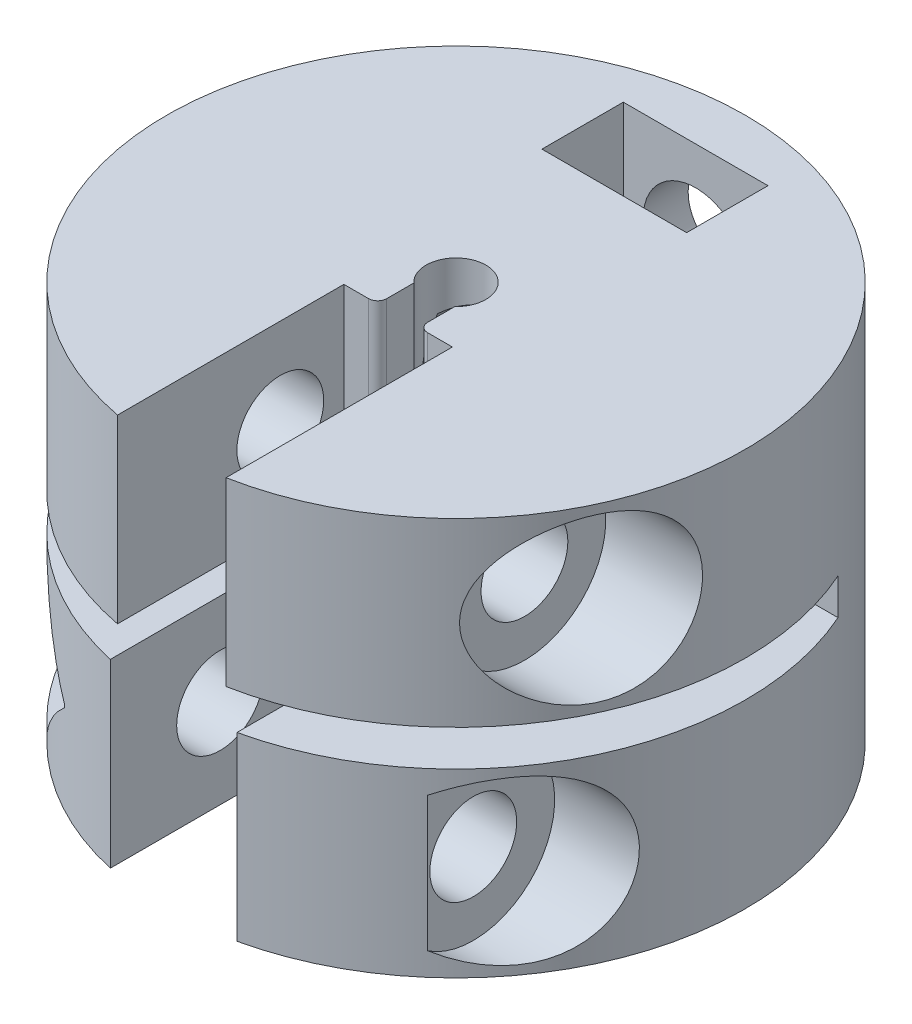
from build123d import *

# Parameters (mm, degrees)
SKETCH1_W                            = 4.75
SKETCH1_H                            = 7
FILLET1_R                            = 1
SKETCH16_W                           = 16
SKETCH16_H                           = 1
CUT_EXTRUDE5_DEPTH                   = 1
CUT_EXTRUDE5_DIRECTION_2_REACH       = 18.492
CUT_EXTRUDE6_REACH                   = 15.304
SKETCH17_W                           = 3.5
SKETCH17_H                           = 5.261387212
CUT_EXTRUDE7_DEPTH                   = 18.408690359
CUT_EXTRUDE7_DEPTH_BACK              = 18.408690359
SKETCH18_R                           = 1.2
CUT_EXTRUDE10_START                  = -6
SKETCH21_R                           = 0.825
CUT_EXTRUDE10_DEPTH                  = 6
CUT_EXTRUDE11_DEPTH                  = 18.26991621
CUT_EXTRUDE11_DEPTH_BACK             = 18.26991621
SKETCH22_R                           = 1.2
CUT_EXTRUDE9_REACH                   = 20.603
CUT_EXTRUDE9_END_RADIUS              = 8
SKETCH20_R                           = 1.2
CUT_EXTRUDE12_REACH                  = 21.585
SKETCH19_R                           = 2.25
CUT_EXTRUDE13_REACH                  = 21.585
CUT_EXTRUDE13_END_RADIUS             = 8
SKETCH24_R                           = 2.25
CUT_EXTRUDE14_REACH                  = 18.492
CUT_EXTRUDE14_END_RADIUS             = 8
SKETCH25_W                           = 2.25
SKETCH25_H                           = 1
CUT_EXTRUDE14_DIRECTION_2_REACH      = 18.492
CUT_EXTRUDE14_DIRECTION_2_END_RADIUS = 8
M2_5_CLEARANCE_HOLE1_D               = 2.9
M2_5_CLEARANCE_HOLE1_DEPTH           = 7.729752102
M2_5_CLEARANCE_HOLE1_TIP             = 0.871247898
CUT_EXTRUDE15_START                  = -12
SKETCH29_W                           = 4
SKETCH29_H                           = 2.25
CUT_EXTRUDE15_DEPTH                  = 12
FILLET3_R                            = 0.25
SKETCH30_R                           = 8
CUT_EXTRUDE19_DEPTH                  = 1


with BuildPart() as part:
    # Sketch1 → Revolve1 (revolve)
    with BuildSketch(Plane.XY, mode=Mode.PRIVATE) as revolve1_sk:
        with Locations((5.625, 3.5)):
            Rectangle(SKETCH1_W, SKETCH1_H)
    revolve(revolve1_sk.sketch.rotate(Axis((0, 0, 0), (0, 1, 0)), 90), axis=Axis((0, 0, 0), (0, 1, 0)))

    # Sketch1<3> → Revolve2 (revolve)
    with BuildSketch(Plane.XY, mode=Mode.PRIVATE) as revolve2_sk:
        Polygon((0.825, 7), (3.25, 7), (8, 7), (8, 12), (0.825, 12), align=None)
    revolve(revolve2_sk.sketch.rotate(Axis((0, 0, 0), (0, 1, 0)), 90), axis=Axis((0, 0, 0), (0, 1, 0)))

    # Fillet1
    fillet1_edges = [part.edges().sort_by_distance(p)[0] for p in [
        (0, 12, 8),
    ]]
    fillet(fillet1_edges, radius=FILLET1_R)

    # Sketch16 → Cut-Extrude5 (cut)
    with BuildSketch(Plane.XY):
        with Locations((0, 5.5)):
            Rectangle(SKETCH16_W, SKETCH16_H)
    extrude(amount=-CUT_EXTRUDE5_DEPTH, mode=Mode.SUBTRACT)

    # Sketch16 → Cut-Extrude5 direction 2 (cut, up to next)
    with BuildSketch(Plane.XY, mode=Mode.PRIVATE) as cut_extrude5_direction_2_sk1:
        with Locations((0, 5.5)):
            Rectangle(SKETCH16_W, SKETCH16_H)
    cut_extrude5_direction_2_tool1 = extrude(cut_extrude5_direction_2_sk1.sketch, amount=CUT_EXTRUDE5_DIRECTION_2_REACH, mode=Mode.PRIVATE) & part.part
    add(cut_extrude5_direction_2_tool1.solids().sort_by_distance((0, 5.5, 0))[0], mode=Mode.SUBTRACT)

    # Sketch17 → Cut-Extrude6 (cut, up to next)
    with BuildSketch(Plane(origin=(0, 5, 0), x_dir=(1, 0, 0), z_dir=(0, 1, 0)), mode=Mode.PRIVATE) as cut_extrude6_sk1:
        with Locations((0, -5.369306394)):
            Rectangle(SKETCH17_W, SKETCH17_H)
    cut_extrude6_tool1 = extrude(cut_extrude6_sk1.sketch, amount=-CUT_EXTRUDE6_REACH, mode=Mode.PRIVATE) & part.part
    add(cut_extrude6_tool1.solids().sort_by_distance((0, 5, 5.369306))[0], mode=Mode.SUBTRACT)

    # Sketch18 → Cut-Extrude7 (cut, two sides: drawn at the far end of the back side and taken through both)
    with BuildSketch(Plane.ZY.offset(-1.75).offset(-CUT_EXTRUDE7_DEPTH_BACK)):
        with Locations((4.772430143, 2.5)):
            Circle(SKETCH18_R)
    extrude(amount=CUT_EXTRUDE7_DEPTH + CUT_EXTRUDE7_DEPTH_BACK, mode=Mode.SUBTRACT)

    # Sketch21 → Cut-Extrude10 (cut)
    with BuildSketch(Plane(origin=(0, 12, 0), x_dir=(1, 0, 0), z_dir=(0, 1, 0)).offset(CUT_EXTRUDE10_START)):
        Circle(SKETCH21_R)
        Polygon((-1.5, -1.6), (-1.5, -11.891029443), (1.5, -11.891029443), (1.5, -1.6), (0.566237583, -1.6), (0.566237583, -0.6), (-0.566237583, -0.6), (-0.566237583, -1.6), align=None)
    extrude(amount=CUT_EXTRUDE10_DEPTH, mode=Mode.SUBTRACT)

    # Sketch22 → Cut-Extrude11 (cut, two sides: drawn at the far end of the back side and taken through both)
    with BuildSketch(Plane(origin=(-1.5, 0, 0), x_dir=(0, 0, -1), z_dir=(1, 0, 0)).offset(-CUT_EXTRUDE11_DEPTH_BACK)):
        with Locations((-3.358116823, 8.5)):
            Circle(SKETCH22_R)
    extrude(amount=CUT_EXTRUDE11_DEPTH + CUT_EXTRUDE11_DEPTH_BACK, mode=Mode.SUBTRACT)

    # Cut-Extrude9: up to this cylinder (the profile starts inside it)
    cut_extrude9_end = Plane(origin=(0, 5.9847245, 0), z_dir=(0, -1, 0)) * Cylinder(CUT_EXTRUDE9_END_RADIUS, 65.175449, mode=Mode.PRIVATE)
    # Sketch20 → Cut-Extrude9 (cut, up to the surface)
    with BuildSketch(Plane(origin=(-3.75, 0, 0), x_dir=(0, 0, -1), z_dir=(1, 0, 0)), mode=Mode.PRIVATE) as cut_extrude9_sk1:
        Polygon((-2.463029066, 2.5), (-3.617729604, 4.5), (-5.927130681, 4.5), (-7.08183122, 2.5), (-5.927130681, 0.5), (-3.617729604, 0.5), align=None)
    cut_extrude9_tool1 = extrude(cut_extrude9_sk1.sketch, amount=-CUT_EXTRUDE9_REACH, mode=Mode.PRIVATE) & cut_extrude9_end
    add(cut_extrude9_tool1.solids().sort_by_distance((-3.75, 2.5, 4.77243))[0], mode=Mode.SUBTRACT)
    # Sketch20 → Cut-Extrude9 (cut, up to the surface)
    with BuildSketch(Plane(origin=(-3.75, 0, 0), x_dir=(0, 0, -1), z_dir=(1, 0, 0)), mode=Mode.PRIVATE) as cut_extrude9_sk2:
        Polygon((-1.048715746, 8.5), (-2.203416284, 10.5), (-4.512817361, 10.5), (-5.6675179, 8.5), (-4.512817361, 6.5), (-2.203416284, 6.5), align=None)
        with Locations((-3.358116823, 8.5)):
            Circle(SKETCH20_R, mode=Mode.SUBTRACT)
    cut_extrude9_tool2 = extrude(cut_extrude9_sk2.sketch, amount=-CUT_EXTRUDE9_REACH, mode=Mode.PRIVATE) & cut_extrude9_end
    add(cut_extrude9_tool2.solids().sort_by_distance((-3.75, 9.469449, 1.678981))[0], mode=Mode.SUBTRACT)

    # Sketch19 → Cut-Extrude12 (cut, up to next)
    with BuildSketch(Plane.ZY.offset(-5.25), mode=Mode.PRIVATE) as cut_extrude12_sk1:
        with Locations((4.772430143, 2.5)):
            Circle(SKETCH19_R)
    cut_extrude12_tool1 = extrude(cut_extrude12_sk1.sketch, amount=-CUT_EXTRUDE12_REACH, mode=Mode.PRIVATE) & part.part
    add(cut_extrude12_tool1.solids().sort_by_distance((5.25, 2.5, 4.77243))[0], mode=Mode.SUBTRACT)

    # Cut-Extrude13: up to this cylinder (the profile starts inside it)
    cut_extrude13_end = Plane(origin=(0, 8.5, 0), z_dir=(0, -1, 0)) * Cylinder(CUT_EXTRUDE13_END_RADIUS, 60.17, mode=Mode.PRIVATE)
    # Sketch24 → Cut-Extrude13 (cut, up to the surface)
    with BuildSketch(Plane.ZY.offset(-5.25), mode=Mode.PRIVATE) as cut_extrude13_sk1:
        with Locations((3.358116823, 8.5)):
            Circle(SKETCH24_R)
    cut_extrude13_tool1 = extrude(cut_extrude13_sk1.sketch, amount=-CUT_EXTRUDE13_REACH, mode=Mode.PRIVATE) & cut_extrude13_end
    add(cut_extrude13_tool1.solids().sort_by_distance((5.25, 8.5, 3.358117))[0], mode=Mode.SUBTRACT)

    # Cut-Extrude14: up to this cylinder (the profile starts inside it)
    cut_extrude14_end = Plane(origin=(0, 5.5, 0), z_dir=(0, -1, 0)) * Cylinder(CUT_EXTRUDE14_END_RADIUS, 53.984, mode=Mode.PRIVATE)
    # Sketch25 → Cut-Extrude14 (cut, up to the surface)
    with BuildSketch(Plane.ZY, mode=Mode.PRIVATE) as cut_extrude14_sk1:
        with Locations((-2.125, 5.5)):
            Rectangle(SKETCH25_W, SKETCH25_H)
    cut_extrude14_tool1 = extrude(cut_extrude14_sk1.sketch, amount=-CUT_EXTRUDE14_REACH, mode=Mode.PRIVATE) & cut_extrude14_end
    add(cut_extrude14_tool1.solids().sort_by_distance((0, 5.5, -2.125))[0], mode=Mode.SUBTRACT)

    # Cut-Extrude14 direction 2: up to this cylinder (the profile starts inside it)
    cut_extrude14_direction_2_end = Plane(origin=(0, 5.5, 0), z_dir=(0, -1, 0)) * Cylinder(CUT_EXTRUDE14_DIRECTION_2_END_RADIUS, 53.984, mode=Mode.PRIVATE)
    # Sketch25 → Cut-Extrude14 direction 2 (cut, up to the surface)
    with BuildSketch(Plane.ZY, mode=Mode.PRIVATE) as cut_extrude14_direction_2_sk1:
        with Locations((-2.125, 5.5)):
            Rectangle(SKETCH25_W, SKETCH25_H)
    cut_extrude14_direction_2_tool1 = extrude(cut_extrude14_direction_2_sk1.sketch, amount=CUT_EXTRUDE14_DIRECTION_2_REACH, mode=Mode.PRIVATE) & cut_extrude14_direction_2_end
    add(cut_extrude14_direction_2_tool1.solids().sort_by_distance((0, 5.5, -2.125))[0], mode=Mode.SUBTRACT)

    # M2.5 Clearance Hole1
    with Locations(Plane(origin=(0, 0, -8), x_dir=(-1, 0, 0), z_dir=(0, 0, -1))):
        with Locations((0, 8.5), (0, 2.5)):
            Hole(M2_5_CLEARANCE_HOLE1_D / 2, depth=M2_5_CLEARANCE_HOLE1_DEPTH)
            with Locations((0, 0, -(M2_5_CLEARANCE_HOLE1_DEPTH + M2_5_CLEARANCE_HOLE1_TIP / 2))):  # 118° drill point
                Cone(0, M2_5_CLEARANCE_HOLE1_D / 2, M2_5_CLEARANCE_HOLE1_TIP, mode=Mode.SUBTRACT)

    # Sketch29 → Cut-Extrude15 (cut)
    with BuildSketch(Plane(origin=(0, 12, 0), x_dir=(1, 0, 0), z_dir=(0, 1, 0)).offset(CUT_EXTRUDE15_START)):
        with Locations((0, 5.5)):
            Rectangle(SKETCH29_W, SKETCH29_H)
    extrude(amount=CUT_EXTRUDE15_DEPTH, mode=Mode.SUBTRACT)

    # Fillet3
    fillet3_edges = [part.edges().sort_by_distance(p)[0] for p in [
        (0.566237583, 9.5, 1.6),
        (-0.566237583, 9.5, 1.6),
    ]]
    fillet(fillet3_edges, radius=FILLET3_R)

    # Sketch30 → Cut-Extrude19 (cut)
    with BuildSketch(Plane(origin=(0, 12, 0), x_dir=(1, 0, 0), z_dir=(0, 1, 0))):
        Circle(SKETCH30_R)
    extrude(amount=-CUT_EXTRUDE19_DEPTH, mode=Mode.SUBTRACT)


solid = part.part
